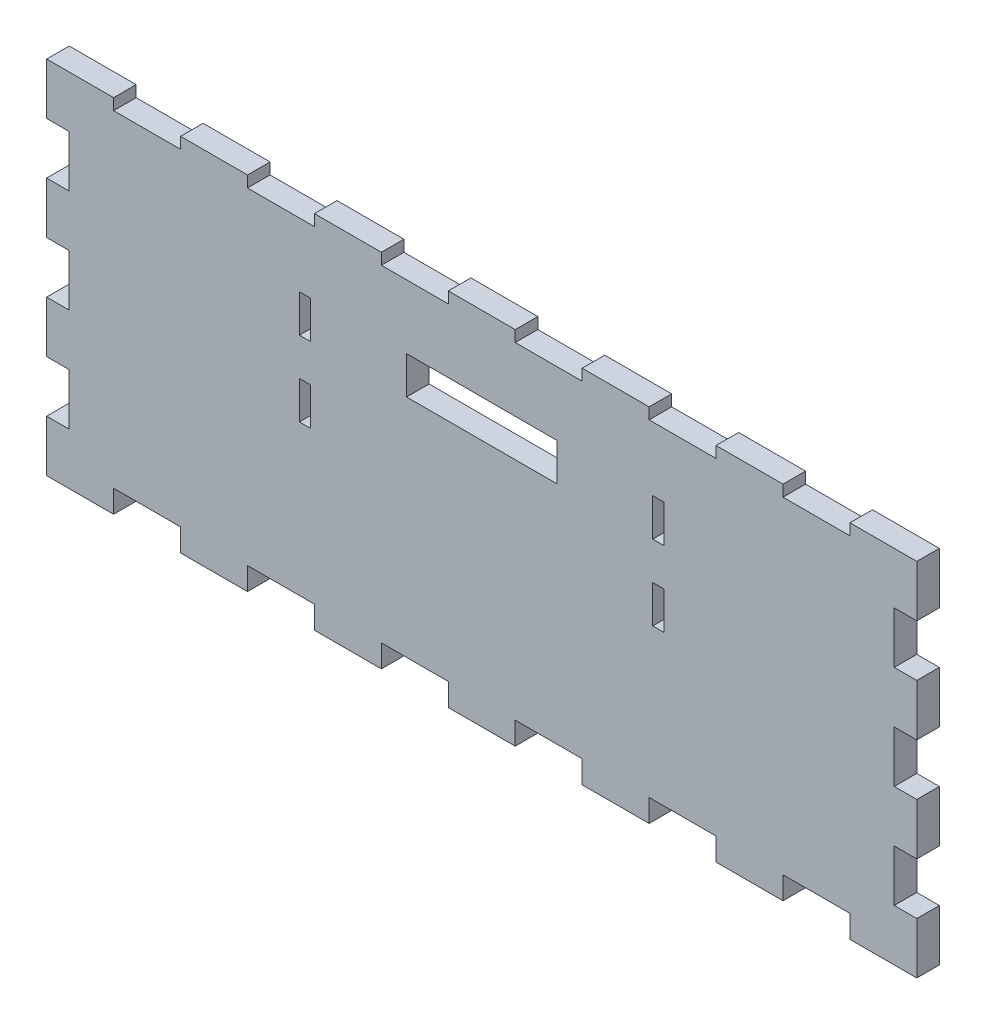
from build123d import *

# Parameters (mm, degrees)
ESBO_O1_W                = 231.5
ESBO_O1_H                = 96
RESSALTO_EXTRUS_O1_DEPTH = 6
CORTE_EXTRUS_O1_REACH    = 127.451
ESBO_O2_W                = 17.812307692
ESBO_O2_H                = 6
CORTE_EXTRUS_O3_REACH    = 127.451
ESBO_O4_W                = 6
ESBO_O4_H                = 13.715714286
CORTE_EXTRUS_O4_REACH    = 127.451
ESBO_O5_W                = 40
ESBO_O5_H                = 10
CORTE_EXTRUS_O5_REACH    = 127.451
ESBO_O6_W                = 3
ESBO_O6_H                = 10


with BuildPart() as part:
    # Esboço1 → Ressalto-extrusão1 (new body)
    with BuildSketch(Plane.XY):
        Rectangle(ESBO_O1_W, ESBO_O1_H)
    extrude(amount=RESSALTO_EXTRUS_O1_DEPTH)

    # Esboço2 → Corte-extrusão1 (cut, up to next)
    with BuildSketch(Plane(origin=(0, 0, 0), x_dir=(-1, 0, 0), z_dir=(0, 0, -1)), mode=Mode.PRIVATE) as corte_extrus_o1_sk1:
        with Locations((17.796153846, -45)):
            Rectangle(ESBO_O2_W, ESBO_O2_H)
    corte_extrus_o1_tool1 = extrude(corte_extrus_o1_sk1.sketch, amount=-CORTE_EXTRUS_O1_REACH, mode=Mode.PRIVATE) & part.part
    # Esboço2 → Corte-extrusão1 (cut, up to next)
    with BuildSketch(Plane(origin=(0, 0, 0), x_dir=(-1, 0, 0), z_dir=(0, 0, -1)), mode=Mode.PRIVATE) as corte_extrus_o1_sk2:
        with Locations((53.416153846, -45)):
            Rectangle(ESBO_O2_W, ESBO_O2_H)
    corte_extrus_o1_tool2 = extrude(corte_extrus_o1_sk2.sketch, amount=-CORTE_EXTRUS_O1_REACH, mode=Mode.PRIVATE) & part.part
    # Esboço2 → Corte-extrusão1 (cut, up to next)
    with BuildSketch(Plane(origin=(0, 0, 0), x_dir=(-1, 0, 0), z_dir=(0, 0, -1)), mode=Mode.PRIVATE) as corte_extrus_o1_sk3:
        with Locations((89.036153846, -45)):
            Rectangle(ESBO_O2_W, ESBO_O2_H)
    corte_extrus_o1_tool3 = extrude(corte_extrus_o1_sk3.sketch, amount=-CORTE_EXTRUS_O1_REACH, mode=Mode.PRIVATE) & part.part
    # Esboço2 → Corte-extrusão1 (cut, up to next)
    with BuildSketch(Plane(origin=(0, 0, 0), x_dir=(-1, 0, 0), z_dir=(0, 0, -1)), mode=Mode.PRIVATE) as corte_extrus_o1_sk4:
        with Locations((-17.823846154, -45)):
            Rectangle(ESBO_O2_W, ESBO_O2_H)
    corte_extrus_o1_tool4 = extrude(corte_extrus_o1_sk4.sketch, amount=-CORTE_EXTRUS_O1_REACH, mode=Mode.PRIVATE) & part.part
    # Esboço2 → Corte-extrusão1 (cut, up to next)
    with BuildSketch(Plane(origin=(0, 0, 0), x_dir=(-1, 0, 0), z_dir=(0, 0, -1)), mode=Mode.PRIVATE) as corte_extrus_o1_sk5:
        with Locations((-53.443846154, -45)):
            Rectangle(ESBO_O2_W, ESBO_O2_H)
    corte_extrus_o1_tool5 = extrude(corte_extrus_o1_sk5.sketch, amount=-CORTE_EXTRUS_O1_REACH, mode=Mode.PRIVATE) & part.part
    # Esboço2 → Corte-extrusão1 (cut, up to next)
    with BuildSketch(Plane(origin=(0, 0, 0), x_dir=(-1, 0, 0), z_dir=(0, 0, -1)), mode=Mode.PRIVATE) as corte_extrus_o1_sk6:
        with Locations((-89.063846154, -45)):
            Rectangle(ESBO_O2_W, ESBO_O2_H)
    corte_extrus_o1_tool6 = extrude(corte_extrus_o1_sk6.sketch, amount=-CORTE_EXTRUS_O1_REACH, mode=Mode.PRIVATE) & part.part
    # Esboço2 → Corte-extrusão1 (cut, up to next)
    with BuildSketch(Plane(origin=(0, 0, 0), x_dir=(-1, 0, 0), z_dir=(0, 0, -1)), mode=Mode.PRIVATE) as corte_extrus_o1_sk7:
        with Locations((-89.063846154, 48)):
            Rectangle(ESBO_O2_W, ESBO_O2_H)
    corte_extrus_o1_tool7 = extrude(corte_extrus_o1_sk7.sketch, amount=-CORTE_EXTRUS_O1_REACH, mode=Mode.PRIVATE) & part.part
    # Esboço2 → Corte-extrusão1 (cut, up to next)
    with BuildSketch(Plane(origin=(0, 0, 0), x_dir=(-1, 0, 0), z_dir=(0, 0, -1)), mode=Mode.PRIVATE) as corte_extrus_o1_sk8:
        with Locations((-53.443846154, 48)):
            Rectangle(ESBO_O2_W, ESBO_O2_H)
    corte_extrus_o1_tool8 = extrude(corte_extrus_o1_sk8.sketch, amount=-CORTE_EXTRUS_O1_REACH, mode=Mode.PRIVATE) & part.part
    # Esboço2 → Corte-extrusão1 (cut, up to next)
    with BuildSketch(Plane(origin=(0, 0, 0), x_dir=(-1, 0, 0), z_dir=(0, 0, -1)), mode=Mode.PRIVATE) as corte_extrus_o1_sk9:
        with Locations((-17.823846154, 48)):
            Rectangle(ESBO_O2_W, ESBO_O2_H)
    corte_extrus_o1_tool9 = extrude(corte_extrus_o1_sk9.sketch, amount=-CORTE_EXTRUS_O1_REACH, mode=Mode.PRIVATE) & part.part
    # Esboço2 → Corte-extrusão1 (cut, up to next)
    with BuildSketch(Plane(origin=(0, 0, 0), x_dir=(-1, 0, 0), z_dir=(0, 0, -1)), mode=Mode.PRIVATE) as corte_extrus_o1_sk10:
        with Locations((17.796153846, 48)):
            Rectangle(ESBO_O2_W, ESBO_O2_H)
    corte_extrus_o1_tool10 = extrude(corte_extrus_o1_sk10.sketch, amount=-CORTE_EXTRUS_O1_REACH, mode=Mode.PRIVATE) & part.part
    # Esboço2 → Corte-extrusão1 (cut, up to next)
    with BuildSketch(Plane(origin=(0, 0, 0), x_dir=(-1, 0, 0), z_dir=(0, 0, -1)), mode=Mode.PRIVATE) as corte_extrus_o1_sk11:
        with Locations((89.036153846, 48)):
            Rectangle(ESBO_O2_W, ESBO_O2_H)
    corte_extrus_o1_tool11 = extrude(corte_extrus_o1_sk11.sketch, amount=-CORTE_EXTRUS_O1_REACH, mode=Mode.PRIVATE) & part.part
    # Esboço2 → Corte-extrusão1 (cut, up to next)
    with BuildSketch(Plane(origin=(0, 0, 0), x_dir=(-1, 0, 0), z_dir=(0, 0, -1)), mode=Mode.PRIVATE) as corte_extrus_o1_sk12:
        with Locations((53.416153846, 48)):
            Rectangle(ESBO_O2_W, ESBO_O2_H)
    corte_extrus_o1_tool12 = extrude(corte_extrus_o1_sk12.sketch, amount=-CORTE_EXTRUS_O1_REACH, mode=Mode.PRIVATE) & part.part
    add(corte_extrus_o1_tool1.solids().sort_by_distance((-17.796154, -45, 0))[0], mode=Mode.SUBTRACT)
    add(corte_extrus_o1_tool2.solids().sort_by_distance((-53.416154, -45, 0))[0], mode=Mode.SUBTRACT)
    add(corte_extrus_o1_tool3.solids().sort_by_distance((-89.036154, -45, 0))[0], mode=Mode.SUBTRACT)
    add(corte_extrus_o1_tool4.solids().sort_by_distance((17.823846, -45, 0))[0], mode=Mode.SUBTRACT)
    add(corte_extrus_o1_tool5.solids().sort_by_distance((53.443846, -45, 0))[0], mode=Mode.SUBTRACT)
    add(corte_extrus_o1_tool6.solids().sort_by_distance((89.063846, -45, 0))[0], mode=Mode.SUBTRACT)
    add(corte_extrus_o1_tool7.solids().sort_by_distance((89.063846, 48, 0))[0], mode=Mode.SUBTRACT)
    add(corte_extrus_o1_tool8.solids().sort_by_distance((53.443846, 48, 0))[0], mode=Mode.SUBTRACT)
    add(corte_extrus_o1_tool9.solids().sort_by_distance((17.823846, 48, 0))[0], mode=Mode.SUBTRACT)
    add(corte_extrus_o1_tool10.solids().sort_by_distance((-17.796154, 48, 0))[0], mode=Mode.SUBTRACT)
    add(corte_extrus_o1_tool11.solids().sort_by_distance((-89.036154, 48, 0))[0], mode=Mode.SUBTRACT)
    add(corte_extrus_o1_tool12.solids().sort_by_distance((-53.416154, 48, 0))[0], mode=Mode.SUBTRACT)

    # Esboço4 → Corte-extrusão3 (cut, up to next)
    with BuildSketch(Plane(origin=(0, 0, 0), x_dir=(-1, 0, 0), z_dir=(0, 0, -1)), mode=Mode.PRIVATE) as corte_extrus_o3_sk1:
        with Locations((112.75, -0.002142857)):
            Rectangle(ESBO_O4_W, ESBO_O4_H)
    corte_extrus_o3_tool1 = extrude(corte_extrus_o3_sk1.sketch, amount=-CORTE_EXTRUS_O3_REACH, mode=Mode.PRIVATE) & part.part
    # Esboço4 → Corte-extrusão3 (cut, up to next)
    with BuildSketch(Plane(origin=(0, 0, 0), x_dir=(-1, 0, 0), z_dir=(0, 0, -1)), mode=Mode.PRIVATE) as corte_extrus_o3_sk2:
        with Locations((112.75, 27.427857143)):
            Rectangle(ESBO_O4_W, ESBO_O4_H)
    corte_extrus_o3_tool2 = extrude(corte_extrus_o3_sk2.sketch, amount=-CORTE_EXTRUS_O3_REACH, mode=Mode.PRIVATE) & part.part
    # Esboço4 → Corte-extrusão3 (cut, up to next)
    with BuildSketch(Plane(origin=(0, 0, 0), x_dir=(-1, 0, 0), z_dir=(0, 0, -1)), mode=Mode.PRIVATE) as corte_extrus_o3_sk3:
        with Locations((-112.75, 27.427857143)):
            Rectangle(ESBO_O4_W, ESBO_O4_H)
    corte_extrus_o3_tool3 = extrude(corte_extrus_o3_sk3.sketch, amount=-CORTE_EXTRUS_O3_REACH, mode=Mode.PRIVATE) & part.part
    # Esboço4 → Corte-extrusão3 (cut, up to next)
    with BuildSketch(Plane(origin=(0, 0, 0), x_dir=(-1, 0, 0), z_dir=(0, 0, -1)), mode=Mode.PRIVATE) as corte_extrus_o3_sk4:
        with Locations((-112.75, -0.002142857)):
            Rectangle(ESBO_O4_W, ESBO_O4_H)
    corte_extrus_o3_tool4 = extrude(corte_extrus_o3_sk4.sketch, amount=-CORTE_EXTRUS_O3_REACH, mode=Mode.PRIVATE) & part.part
    # Esboço4 → Corte-extrusão3 (cut, up to next)
    with BuildSketch(Plane(origin=(0, 0, 0), x_dir=(-1, 0, 0), z_dir=(0, 0, -1)), mode=Mode.PRIVATE) as corte_extrus_o3_sk5:
        with Locations((-112.75, -27.432142857)):
            Rectangle(ESBO_O4_W, ESBO_O4_H)
    corte_extrus_o3_tool5 = extrude(corte_extrus_o3_sk5.sketch, amount=-CORTE_EXTRUS_O3_REACH, mode=Mode.PRIVATE) & part.part
    # Esboço4 → Corte-extrusão3 (cut, up to next)
    with BuildSketch(Plane(origin=(0, 0, 0), x_dir=(-1, 0, 0), z_dir=(0, 0, -1)), mode=Mode.PRIVATE) as corte_extrus_o3_sk6:
        with Locations((112.75, -27.432142857)):
            Rectangle(ESBO_O4_W, ESBO_O4_H)
    corte_extrus_o3_tool6 = extrude(corte_extrus_o3_sk6.sketch, amount=-CORTE_EXTRUS_O3_REACH, mode=Mode.PRIVATE) & part.part
    add(corte_extrus_o3_tool1.solids().sort_by_distance((-112.75, -0.002143, 0))[0], mode=Mode.SUBTRACT)
    add(corte_extrus_o3_tool2.solids().sort_by_distance((-112.75, 27.427857, 0))[0], mode=Mode.SUBTRACT)
    add(corte_extrus_o3_tool3.solids().sort_by_distance((112.75, 27.427857, 0))[0], mode=Mode.SUBTRACT)
    add(corte_extrus_o3_tool4.solids().sort_by_distance((112.75, -0.002143, 0))[0], mode=Mode.SUBTRACT)
    add(corte_extrus_o3_tool5.solids().sort_by_distance((112.75, -27.432143, 0))[0], mode=Mode.SUBTRACT)
    add(corte_extrus_o3_tool6.solids().sort_by_distance((-112.75, -27.432143, 0))[0], mode=Mode.SUBTRACT)

    # Esboço5 → Corte-extrusão4 (cut, up to next)
    with BuildSketch(Plane(origin=(0, 0, 0), x_dir=(-1, 0, 0), z_dir=(0, 0, -1)), mode=Mode.PRIVATE) as corte_extrus_o4_sk1:
        with Locations((0, 23)):
            Rectangle(ESBO_O5_W, ESBO_O5_H)
    corte_extrus_o4_tool1 = extrude(corte_extrus_o4_sk1.sketch, amount=-CORTE_EXTRUS_O4_REACH, mode=Mode.PRIVATE) & part.part
    add(corte_extrus_o4_tool1.solids().sort_by_distance((0, 23, 0))[0], mode=Mode.SUBTRACT)

    # Esboço6 → Corte-extrusão5 (cut, up to next)
    with BuildSketch(Plane(origin=(0, 0, 0), x_dir=(-1, 0, 0), z_dir=(0, 0, -1)), mode=Mode.PRIVATE) as corte_extrus_o5_sk1:
        with Locations((47, 23)):
            Rectangle(ESBO_O6_W, ESBO_O6_H)
    corte_extrus_o5_tool1 = extrude(corte_extrus_o5_sk1.sketch, amount=-CORTE_EXTRUS_O5_REACH, mode=Mode.PRIVATE) & part.part
    # Esboço6 → Corte-extrusão5 (cut, up to next)
    with BuildSketch(Plane(origin=(0, 0, 0), x_dir=(-1, 0, 0), z_dir=(0, 0, -1)), mode=Mode.PRIVATE) as corte_extrus_o5_sk2:
        with Locations((-47, 23)):
            Rectangle(ESBO_O6_W, ESBO_O6_H)
    corte_extrus_o5_tool2 = extrude(corte_extrus_o5_sk2.sketch, amount=-CORTE_EXTRUS_O5_REACH, mode=Mode.PRIVATE) & part.part
    # Esboço6 → Corte-extrusão5 (cut, up to next)
    with BuildSketch(Plane(origin=(0, 0, 0), x_dir=(-1, 0, 0), z_dir=(0, 0, -1)), mode=Mode.PRIVATE) as corte_extrus_o5_sk3:
        with Locations((-47, 3)):
            Rectangle(ESBO_O6_W, ESBO_O6_H)
    corte_extrus_o5_tool3 = extrude(corte_extrus_o5_sk3.sketch, amount=-CORTE_EXTRUS_O5_REACH, mode=Mode.PRIVATE) & part.part
    # Esboço6 → Corte-extrusão5 (cut, up to next)
    with BuildSketch(Plane(origin=(0, 0, 0), x_dir=(-1, 0, 0), z_dir=(0, 0, -1)), mode=Mode.PRIVATE) as corte_extrus_o5_sk4:
        with Locations((47, 3)):
            Rectangle(ESBO_O6_W, ESBO_O6_H)
    corte_extrus_o5_tool4 = extrude(corte_extrus_o5_sk4.sketch, amount=-CORTE_EXTRUS_O5_REACH, mode=Mode.PRIVATE) & part.part
    add(corte_extrus_o5_tool1.solids().sort_by_distance((-47, 23, 0))[0], mode=Mode.SUBTRACT)
    add(corte_extrus_o5_tool2.solids().sort_by_distance((47, 23, 0))[0], mode=Mode.SUBTRACT)
    add(corte_extrus_o5_tool3.solids().sort_by_distance((47, 3, 0))[0], mode=Mode.SUBTRACT)
    add(corte_extrus_o5_tool4.solids().sort_by_distance((-47, 3, 0))[0], mode=Mode.SUBTRACT)


solid = part.part
